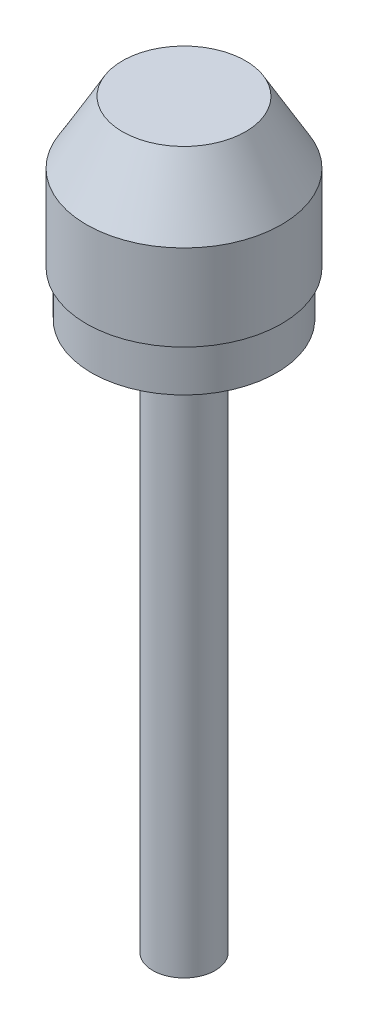
from build123d import *

# Parameters (mm, degrees)
SKETCH_1_R      = 2
EXTRUDE_1_DEPTH = 35
SKETCH_2_R      = 5.925
EXTRUDE_2_DEPTH = 3
SKETCH_3_R      = 6.25
EXTRUDE_3_DEPTH = 9.5
CHAMFER_1_SIZE  = 4
CHAMFER_1_SIZE2 = 2.309401077
CHAMFER_2_SIZE  = 0.2
CHAMFER_2_SIZE2 = 0.115470054


with BuildPart() as part:
    # 草图1 → 凸台-拉伸1 (new body)
    with BuildSketch(Plane(origin=(0, 0, 0), x_dir=(1, 0, 0), z_dir=(0, 1, 0))):
        with Locations(Location((0, 0, 0), (0, 0, 270))):
            Circle(SKETCH_1_R)
    extrude(amount=EXTRUDE_1_DEPTH)

    # 草图2 → 凸台-拉伸2 (add)
    with BuildSketch(Plane(origin=(0, 35, 0), x_dir=(1, 0, 0), z_dir=(0, 1, 0))):
        with Locations(Location((0, 0, 0), (0, 0, 270))):
            Circle(SKETCH_2_R)
    extrude(amount=EXTRUDE_2_DEPTH)

    # 草图3 → 凸台-拉伸3 (add)
    with BuildSketch(Plane(origin=(0, 38, 0), x_dir=(1, 0, 0), z_dir=(0, 1, 0))):
        with Locations(Location((0, 0, 0), (0, 0, 270))):
            Circle(SKETCH_3_R)
    extrude(amount=EXTRUDE_3_DEPTH)

    # 倒角1
    chamfer_1_edges = [part.edges().sort_by_distance(p)[0] for p in [
        (0, 47.5, -6.25),
    ]]
    chamfer_1_side = [part.faces().sort_by_distance(p)[0] for p in [
        (0, 42.75, -6.25),
    ]]
    chamfer(chamfer_1_edges, length=CHAMFER_1_SIZE, length2=CHAMFER_1_SIZE2, reference=chamfer_1_side[0])

    # 倒角2
    chamfer_2_edges = [part.edges().sort_by_distance(p)[0] for p in [
        (0, 35, -5.925),
    ]]
    chamfer_2_side = [part.faces().sort_by_distance(p)[0] for p in [
        (0, 35, -5.757415693),
    ]]
    chamfer(chamfer_2_edges, length=CHAMFER_2_SIZE, length2=CHAMFER_2_SIZE2, reference=chamfer_2_side[0])


solid = part.part
